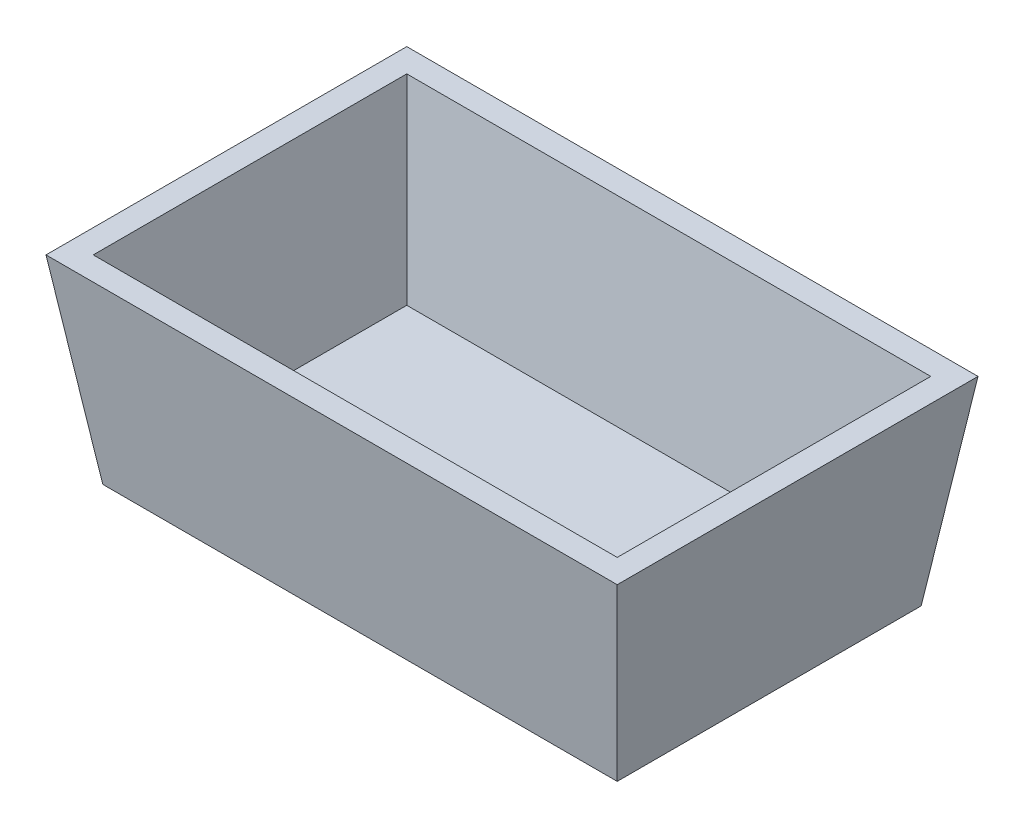
from build123d import *

# Parameters (mm, degrees)
SHELL1_T           = -25.4
SKETCH5_W          = 929.67589299
SKETCH5_H          = 559.095756772
CUT_EXTRUDE1_DEPTH = 50.8


with BuildPart() as part:
    # Sketch2 → Loft1 section 0
    with BuildSketch(Plane(origin=(0, 266.7, 0), x_dir=(1, 0, 0), z_dir=(0, 1, 0))):
        with BuildLine():
            Line((-38.1, -38.1), (596.9, -38.1))
            Line((596.9, -38.1), (596.9, 368.3))
            Line((596.9, 368.3), (-38.1, 368.3))
            Line((-38.1, 368.3), (-38.1, -38.1))
        make_face()
    # Sketch1 → Loft1 section 1
    with BuildSketch(Plane(origin=(0, 0, 0), x_dir=(1, 0, 0), z_dir=(0, 1, 0))):
        with BuildLine():
            Line((0, 0), (558.8, 0))
            Line((558.8, 0), (558.8, 330.2))
            Line((558.8, 330.2), (0, 330.2))
            Line((0, 330.2), (0, 0))
        make_face()
    loft()

    # Shell1
    shell1_openings = [part.faces().sort_by_distance(p)[0] for p in [
        (279.4, 266.7, -165.1),
    ]]
    offset(amount=SHELL1_T, openings=shell1_openings, kind=Kind.INTERSECTION)

    # Sketch5 → Cut-Extrude1 (cut)
    with BuildSketch(Plane(origin=(0, 215.9, 0), x_dir=(1, 0, 0), z_dir=(0, 1, 0))):
        with Locations((273.30728983, 168.325552443)):
            Rectangle(SKETCH5_W, SKETCH5_H)
    extrude(amount=CUT_EXTRUDE1_DEPTH, mode=Mode.SUBTRACT)


solid = part.part
